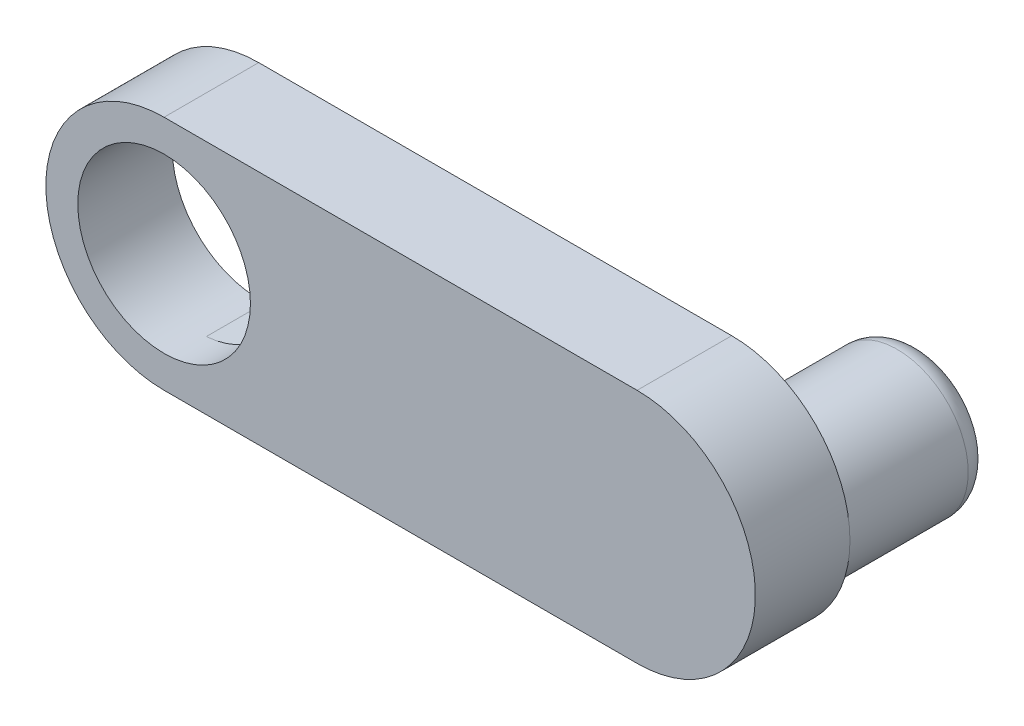
from build123d import *

# Parameters (mm, degrees)
EXTRUDE_3_DEPTH     = 4
SKETCH_4_R          = 3
EXTRUDE_4_DEPTH     = 6
CUT_EXTRUDE_1_DEPTH = 2.5
SKETCH_7_R          = 3.65
CUT_EXTRUDE_2_DEPTH = 27.874709301
FILLET_1_R          = 1


with BuildPart() as part:
    # 草图1 → 凸台-拉伸3 (new body)
    with BuildSketch(Plane.XY):
        with BuildLine():
            Line((0, 5), (20, 5))
            ThreePointArc((20, 5), (25, 0), (20, -5))
            Line((20, -5), (0, -5))
            ThreePointArc((0, -5), (-5, 0), (0, 5))
        make_face()
    extrude(amount=EXTRUDE_3_DEPTH)

    # 草图4 → 凸台-拉伸4 (add)
    with BuildSketch(Plane.XY):
        with Locations((22, 0)):
            Circle(SKETCH_4_R)
    extrude(amount=-EXTRUDE_4_DEPTH)

    # 草图6 → 切除-拉伸1 (cut)
    with BuildSketch(Plane(origin=(0, 0, 0), x_dir=(-1, 0, 0), z_dir=(0, 0, -1))):
        with BuildLine():
            Line((-16.1875, 2.392664571), (-0.28515625, 3.638844035))
            ThreePointArc((-0.28515625, 3.638844035), (3.65, 0), (-0.28515625, -3.638844035))
            Line((-0.28515625, -3.638844035), (-16.1875, -2.392664571))
            ThreePointArc((-16.1875, -2.392664571), (-18.4, 0), (-16.1875, 2.392664571))
        make_face()
    extrude(amount=-CUT_EXTRUDE_1_DEPTH, mode=Mode.SUBTRACT)

    # 草图7 → 切除-拉伸2 (cut, through all)
    with BuildSketch(Plane(origin=(0, 0, 2.5), x_dir=(-1, 0, 0), z_dir=(0, 0, -1))):
        Circle(SKETCH_7_R)
    extrude(amount=-CUT_EXTRUDE_2_DEPTH, mode=Mode.SUBTRACT)

    # 圆角1
    fillet_1_edges = [part.edges().sort_by_distance(p)[0] for p in [
        (19, 0, -6),
    ]]
    fillet(fillet_1_edges, radius=FILLET_1_R)


solid = part.part
